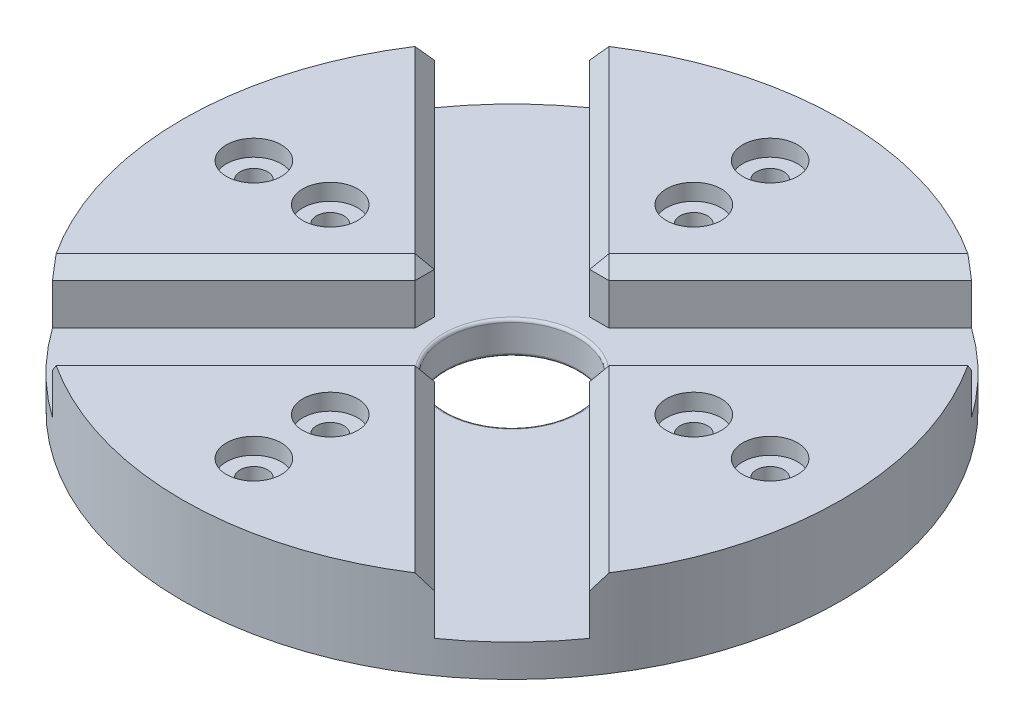
from build123d import *
from OCP.BRepFilletAPI import BRepFilletAPI_MakeChamfer

# Parameters (mm, degrees)
SKETCH_1_R          = 12
SKETCH_1_R_2        = 0.5
EXTRUDE_1_DEPTH     = 1.18
SKETCH_2_R          = 0.5
EXTRUDE_2_DEPTH     = 2
SKETCH_3_R          = 1
CUT_EXTRUDE_1_DEPTH = 0.6
CHAMFER_1_SIZE      = 0.5
CHAMFER_1_SIZE2     = 0.500055206
SKETCH_4_R          = 2.4
CUT_EXTRUDE_2_DEPTH = 4.6
FILLET_1_R          = 0.1


with BuildPart() as part:
    # 草图1 → 凸台-拉伸1 (new body)
    with BuildSketch(Plane(origin=(0, 0, 0), x_dir=(1, 0, 0), z_dir=(0, 1, 0))):
        with Locations(Location((0, 0, 0), (0, 0, 270))):
            Circle(SKETCH_1_R)
        with Locations(Location((-9.4, 0, 0), (0, 0, 270))):
            Circle(SKETCH_1_R_2, mode=Mode.SUBTRACT)
        with Locations(Location((-6.62, 0, 0), (0, 0, 270))):
            Circle(SKETCH_1_R_2, mode=Mode.SUBTRACT)
        with Locations(Location((0, 9.4, 0), (0, 0, 270))):
            Circle(SKETCH_1_R_2, mode=Mode.SUBTRACT)
        with Locations(Location((0, 6.62, 0), (0, 0, 270))):
            Circle(SKETCH_1_R_2, mode=Mode.SUBTRACT)
        with Locations(Location((9.4, 0, 0), (0, 0, 270))):
            Circle(SKETCH_1_R_2, mode=Mode.SUBTRACT)
        with Locations(Location((6.62, 0, 0), (0, 0, 270))):
            Circle(SKETCH_1_R_2, mode=Mode.SUBTRACT)
        with Locations(Location((0, -9.4, 0), (0, 0, 270))):
            Circle(SKETCH_1_R_2, mode=Mode.SUBTRACT)
        with Locations(Location((0, -6.62, 0), (0, 0, 270))):
            Circle(SKETCH_1_R_2, mode=Mode.SUBTRACT)
    extrude(amount=EXTRUDE_1_DEPTH)

    # 草图2 → 凸台-拉伸2 (add)
    # profile 1 of 4: a face of its own
    with BuildSketch(Plane(origin=(0, 1.18, 0), x_dir=(1, 0, 0), z_dir=(0, 1, 0))):
        with BuildLine():
            Line((-2.828427125, 0), (-9.780813828, 6.952386703))
            ThreePointArc((-9.780813828, 6.952386703), (-12, 0), (-9.780813828, -6.952386703))
            Line((-9.780813828, -6.952386703), (-2.828427125, 0))
        make_face()
        with Locations(Location((-9.4, 0, 0), (0, 0, 270))):
            Circle(SKETCH_2_R, mode=Mode.SUBTRACT)
        with Locations(Location((-6.62, 0, 0), (0, 0, 270))):
            Circle(SKETCH_2_R, mode=Mode.SUBTRACT)
    # profile 2 of 4: a face of its own
    with BuildSketch(Plane(origin=(0, 1.18, 0), x_dir=(1, 0, 0), z_dir=(0, 1, 0))):
        with BuildLine():
            Line((-6.952386703, 9.780813828), (0, 2.828427125))
            Line((0, 2.828427125), (6.952386703, 9.780813828))
            ThreePointArc((6.952386703, 9.780813828), (0, 12), (-6.952386703, 9.780813828))
        make_face()
        with Locations(Location((0, 6.62, 0), (0, 0, 270))):
            Circle(SKETCH_2_R, mode=Mode.SUBTRACT)
        with Locations(Location((0, 9.4, 0), (0, 0, 270))):
            Circle(SKETCH_2_R, mode=Mode.SUBTRACT)
    # profile 3 of 4: a face of its own
    with BuildSketch(Plane(origin=(0, 1.18, 0), x_dir=(1, 0, 0), z_dir=(0, 1, 0))):
        with BuildLine():
            ThreePointArc((12, 0), (11.431748902, 3.648988495), (9.780813828, 6.952386703))
            Line((9.780813828, 6.952386703), (2.828427125, 0))
            Line((2.828427125, 0), (9.780813828, -6.952386703))
            ThreePointArc((9.780813828, -6.952386703), (11.431748902, -3.648988495), (12, 0))
        make_face()
        with Locations(Location((6.62, 0, 0), (0, 0, 270))):
            Circle(SKETCH_2_R, mode=Mode.SUBTRACT)
        with Locations(Location((9.4, 0, 0), (0, 0, 270))):
            Circle(SKETCH_2_R, mode=Mode.SUBTRACT)
    # profile 4 of 4: a face of its own
    with BuildSketch(Plane(origin=(0, 1.18, 0), x_dir=(1, 0, 0), z_dir=(0, 1, 0))):
        with BuildLine():
            Line((0.000156121, -2.828271004), (-6.952386703, -9.780813828))
            ThreePointArc((-6.952386703, -9.780813828), (0.000662371, -11.999999982), (6.953466414, -9.780046259))
            Line((6.953466414, -9.780046259), (0.000156121, -2.828271004))
        make_face()
        with Locations(Location((0, -9.4, 0), (0, 0, 270))):
            Circle(SKETCH_2_R, mode=Mode.SUBTRACT)
        with Locations(Location((0, -6.62, 0), (0, 0, 270))):
            Circle(SKETCH_2_R, mode=Mode.SUBTRACT)
    extrude(amount=EXTRUDE_2_DEPTH)

    # 草图3 → 切除-拉伸1 (cut)
    with BuildSketch(Plane(origin=(0, 3.18, 0), x_dir=(1, 0, 0), z_dir=(0, 1, 0))):
        with Locations(Location((-9.4, 0, 0), (0, 0, 270))):
            Circle(SKETCH_3_R)
        with Locations(Location((-6.62, 0, 0), (0, 0, 270))):
            Circle(SKETCH_3_R)
        with Locations(Location((0, 9.4, 0), (0, 0, 270))):
            Circle(SKETCH_3_R)
        with Locations(Location((0, 6.62, 0), (0, 0, 270))):
            Circle(SKETCH_3_R)
        with Locations(Location((9.4, 0, 0), (0, 0, 270))):
            Circle(SKETCH_3_R)
        with Locations(Location((6.62, 0, 0), (0, 0, 270))):
            Circle(SKETCH_3_R)
        with Locations(Location((0, -9.4, 0), (0, 0, 270))):
            Circle(SKETCH_3_R)
        with Locations(Location((0, -6.62, 0), (0, 0, 270))):
            Circle(SKETCH_3_R)
    extrude(amount=-CUT_EXTRUDE_1_DEPTH, mode=Mode.SUBTRACT)

    # 倒角1: one chamfer whose edges measure the first distance from different faces: ONE call of the kernel's chamfer builder (chamfer() names one face for all edges)
    chamfer_1_edges_1 = [part.edges().sort_by_distance(p)[0] for p in [
        (-6.304620476, 3.18, 3.476193351),
        (-2.828427125, 2.18, 0),
        (-6.304620476, 3.18, -3.476193351),
        (-3.476193351, 3.18, -6.304620476),
        (0, 2.18, -2.828427125),
        (3.476193351, 3.18, -6.304620476),
        (6.304620476, 3.18, -3.476193351),
        (2.828427125, 2.18, 0),
        (6.304620476, 3.18, 3.476193351),
        (3.476811268, 3.18, 6.304158631),
        (-3.476115291, 3.18, 6.304542416),
    ]]
    chamfer_1_edges_2 = [part.edges().sort_by_distance(p)[0] for p in [
        (0.000156121, 2.18, 2.828271004),
    ]]
    chamfer_1_side_2 = [part.faces().sort_by_distance(p)[0] for p in [
        (-3.476115291, 2.18, 6.304542416),
    ]]
    chamfer_1 = BRepFilletAPI_MakeChamfer(part.part.solid().wrapped)
    for e in chamfer_1_edges_1:
        chamfer_1.Add(CHAMFER_1_SIZE, e.wrapped)
    for e in chamfer_1_edges_2:
        chamfer_1.Add(CHAMFER_1_SIZE, CHAMFER_1_SIZE2, e.wrapped, chamfer_1_side_2[0].wrapped)  # the first distance lies on this face
    add(Compound.cast(chamfer_1.Shape()), mode=Mode.REPLACE)

    # 草图4 → 切除-拉伸2 (cut)
    with BuildSketch(Plane(origin=(0, 1.18, 0), x_dir=(1, 0, 0), z_dir=(0, 1, 0))):
        with Locations(Location((0, 0, 0), (0, 0, 270))):
            Circle(SKETCH_4_R)
    extrude(amount=-CUT_EXTRUDE_2_DEPTH, mode=Mode.SUBTRACT)

    # 圆角1
    fillet_1_edges = [part.edges().sort_by_distance(p)[0] for p in [
        (0, 0, -2.4),
        (0, 1.18, -2.4),
    ]]
    fillet(fillet_1_edges, radius=FILLET_1_R)


solid = part.part
